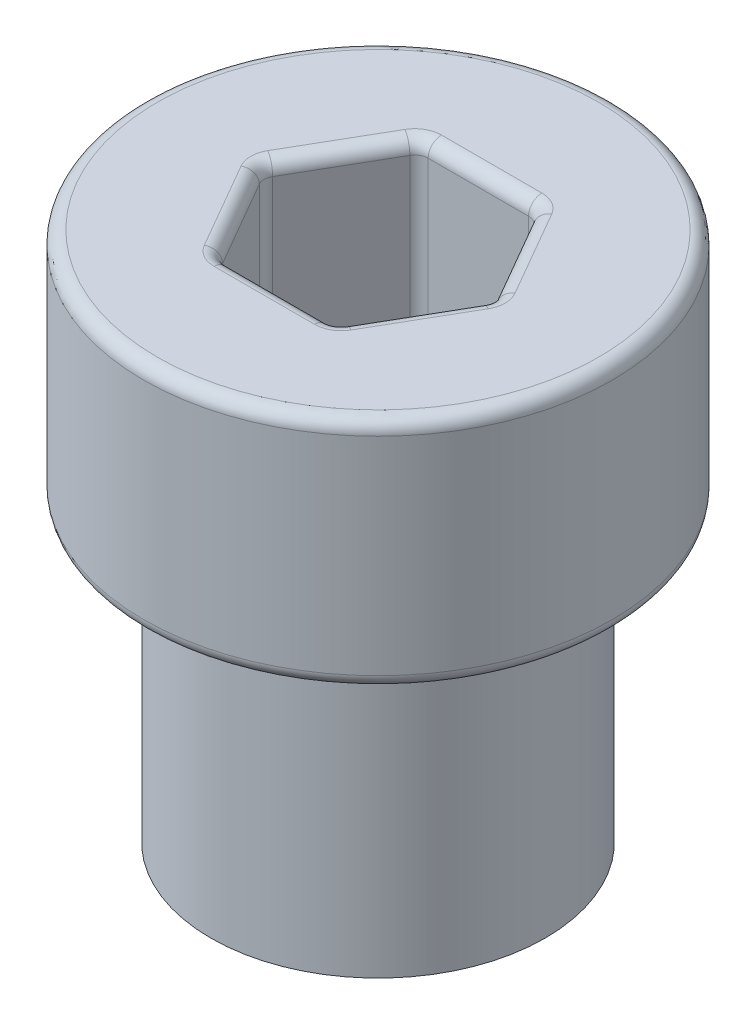
from build123d import *

# Parameters (mm, degrees)
HEAD_SKETCH_R                  = 3.5
HEAD_DEPTH                     = 3.5
THREADED_SECTION_STUB_SKETCH_R = 2.5
THREADED_SECTION_DEPTH         = 5
COSMETIC_FILLETS_R             = 0.2
BOTTOM_CHAMFER_SIZE            = 1
BOTTOM_CHAMFER_SIZE2           = 0.577350269


with BuildPart() as part:
    # Head Sketch → Head (new body)
    with BuildSketch(Plane(origin=(0, 0, 0), x_dir=(1, 0, 0), z_dir=(0, 1, 0))):
        with Locations(Location((0, 0, 0), (0, 0, 270))):
            Circle(HEAD_SKETCH_R)
        Polygon((-0.866025404, 1.5), (-1.732050808, 0), (-0.866025404, -1.5), (0.866025404, -1.5), (1.732050808, 0), (0.866025404, 1.5), align=None, mode=Mode.SUBTRACT)
    extrude(amount=HEAD_DEPTH)

    # Threaded Section Stub Sketch → Threaded Section (add)
    with BuildSketch(Plane(origin=(0, 0, 0), x_dir=(1, 0, 0), z_dir=(0, 1, 0))):
        with Locations(Location((0, 0, 0), (0, 0, 270))):
            Circle(THREADED_SECTION_STUB_SKETCH_R)
    extrude(amount=-THREADED_SECTION_DEPTH)

    # Cosmetic Fillets
    cosmetic_fillets_edges = [part.edges().sort_by_distance(p)[0] for p in [
        (-0.866025404, 1.75, -1.5),
        (-1.299038106, 0, 0.75),
        (-1.732050808, 1.75, 0),
        (0, 0, 1.5),
        (-0.866025404, 1.75, 1.5),
        (1.299038106, 0, 0.75),
        (0.866025404, 1.75, 1.5),
        (1.299038106, 0, -0.75),
        (1.732050808, 1.75, 0),
        (0, 3.5, -1.5),
        (-1.299038106, 3.5, -0.75),
        (-1.299038106, 3.5, 0.75),
        (0, 3.5, 1.5),
        (1.299038106, 3.5, 0.75),
        (1.299038106, 3.5, -0.75),
        (0, 0, -3.5),
        (0, 3.5, -3.5),
        (0, 0, -1.5),
        (0.866025404, 1.75, -1.5),
        (-1.299038106, 0, -0.75),
    ]]
    fillet(cosmetic_fillets_edges, radius=COSMETIC_FILLETS_R)

    # Bottom Chamfer
    bottom_chamfer_edges = [part.edges().sort_by_distance(p)[0] for p in [
        (0, -5, -2.5),
    ]]
    bottom_chamfer_side = [part.faces().sort_by_distance(p)[0] for p in [
        (0, -5, 0),
    ]]
    chamfer(bottom_chamfer_edges, length=BOTTOM_CHAMFER_SIZE, length2=BOTTOM_CHAMFER_SIZE2, reference=bottom_chamfer_side[0])


solid = part.part
